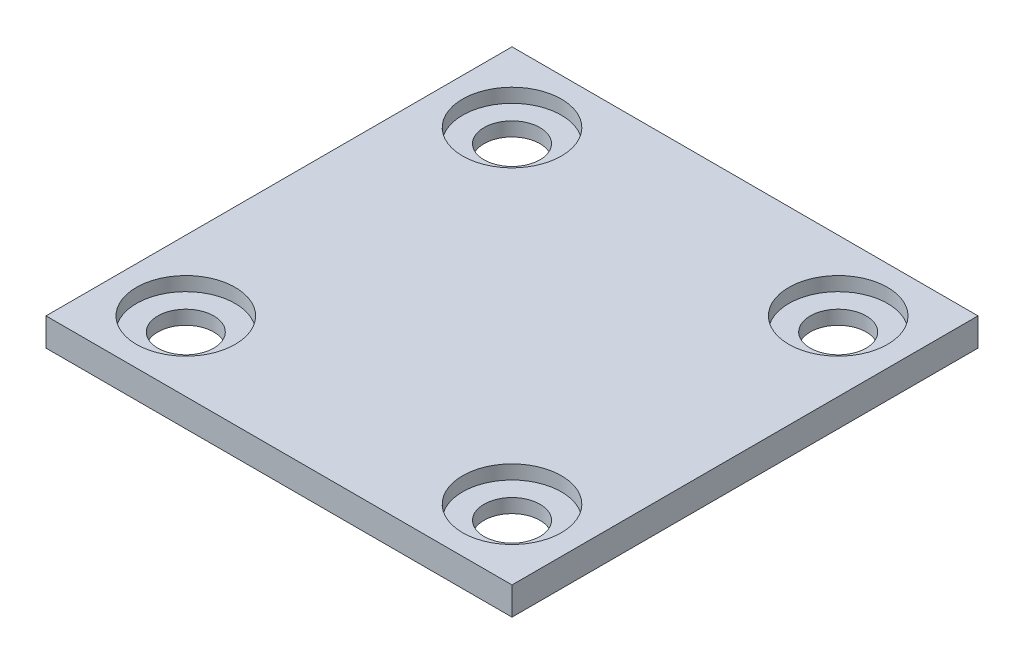
from build123d import *

# Parameters (mm, degrees)
SKETCH1_W           = 50
SKETCH1_H           = 50
SKETCH1_R           = 3
BOSS_EXTRUDE1_DEPTH = 3
SKETCH2_R           = 5.3
CUT_EXTRUDE1_DEPTH  = 1.5


with BuildPart() as part:
    # Sketch1 → Boss-Extrude1 (new body)
    with BuildSketch(Plane(origin=(0, 0, 0), x_dir=(1, 0, 0), z_dir=(0, 1, 0))):
        Rectangle(SKETCH1_W, SKETCH1_H)
        with Locations(Location((-17.5, 17.5, 0), (0, 0, 270))):
            Circle(SKETCH1_R, mode=Mode.SUBTRACT)
        with Locations(Location((17.5, 17.5, 0), (0, 0, 270))):
            Circle(SKETCH1_R, mode=Mode.SUBTRACT)
        with Locations(Location((-17.5, -17.5, 0), (0, 0, 270))):
            Circle(SKETCH1_R, mode=Mode.SUBTRACT)
        with Locations(Location((17.5, -17.5, 0), (0, 0, 270))):
            Circle(SKETCH1_R, mode=Mode.SUBTRACT)
    extrude(amount=BOSS_EXTRUDE1_DEPTH)

    # Sketch2 → Cut-Extrude1 (cut)
    with BuildSketch(Plane(origin=(0, 3, 0), x_dir=(1, 0, 0), z_dir=(0, 1, 0))):
        with Locations(Location((-17.5, 17.5, 0), (0, 0, 270))):
            Circle(SKETCH2_R)
        with Locations(Location((17.5, 17.5, 0), (0, 0, 270))):
            Circle(SKETCH2_R)
        with Locations(Location((17.5, -17.5, 0), (0, 0, 270))):
            Circle(SKETCH2_R)
        with Locations(Location((-17.5, -17.5, 0), (0, 0, 270))):
            Circle(SKETCH2_R)
    extrude(amount=-CUT_EXTRUDE1_DEPTH, mode=Mode.SUBTRACT)


solid = part.part
